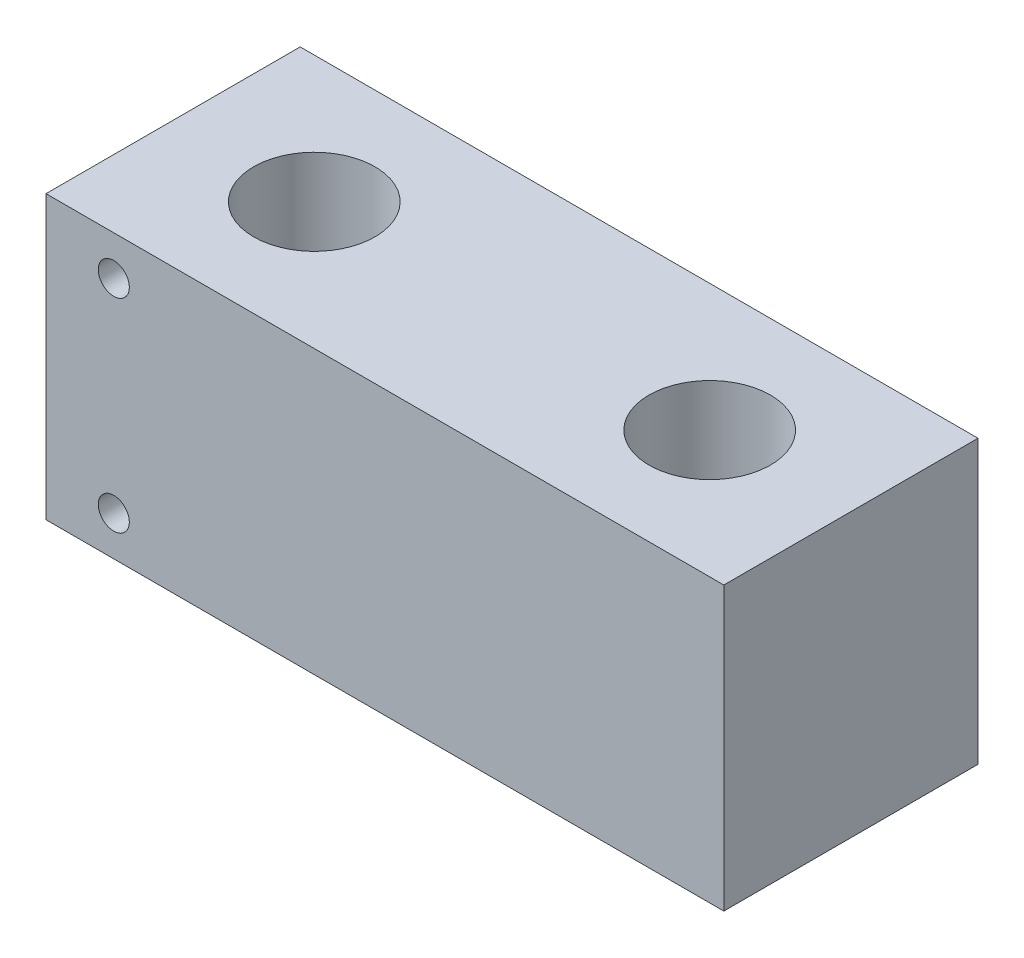
from build123d import *

# Parameters (mm, degrees)
SKETCH_1_W             = 120
SKETCH_1_H             = 45
SKETCH_1_R             = 10.75
EXTRUDE_1_DEPTH        = 50
HOLE_WIZARD_M6_1_D     = 5.5
HOLE_WIZARD_M6_1_DEPTH = 15
HOLE_WIZARD_M6_1_TIP   = 1.652366702


with BuildPart() as part:
    # 草图1 → 凸台-拉伸1 (new body)
    with BuildSketch(Plane(origin=(0, 0, 0), x_dir=(1, 0, 0), z_dir=(0, 1, 0))):
        Rectangle(SKETCH_1_W, SKETCH_1_H)
        with Locations(Location((-35, 0, 0), (0, 0, 270))):
            Circle(SKETCH_1_R, mode=Mode.SUBTRACT)
        with Locations(Location((35, 0, 0), (0, 0, 90))):
            Circle(SKETCH_1_R, mode=Mode.SUBTRACT)
    extrude(amount=EXTRUDE_1_DEPTH)

    # M6 螺纹孔1
    with Locations(Plane(origin=(-48, 43, 22.5), x_dir=(1, 0, 0), z_dir=(0, 0, 1))):
        with Locations((0, 0), (0, -36)):
            Hole(HOLE_WIZARD_M6_1_D / 2, depth=HOLE_WIZARD_M6_1_DEPTH)
            with Locations((0, 0, -(HOLE_WIZARD_M6_1_DEPTH + HOLE_WIZARD_M6_1_TIP / 2))):  # 118° drill point
                Cone(0, HOLE_WIZARD_M6_1_D / 2, HOLE_WIZARD_M6_1_TIP, mode=Mode.SUBTRACT)


solid = part.part
